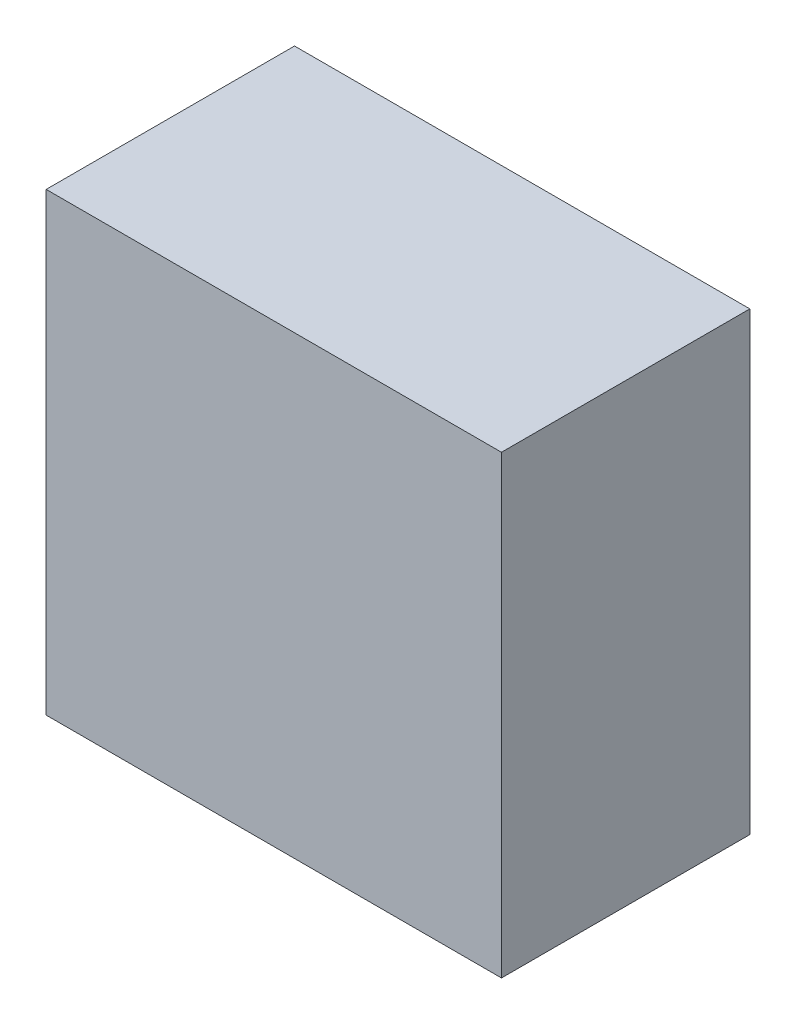
from build123d import *

# Parameters (mm, degrees)
ESQUISSE1_W        = 22
ESQUISSE1_H        = 22
BOSS_EXTRU_1_DEPTH = 12


with BuildPart() as part:
    # Esquisse1 → Boss.-Extru.1 (new body)
    with BuildSketch(Plane.XY):
        Rectangle(ESQUISSE1_W, ESQUISSE1_H)
    extrude(amount=BOSS_EXTRU_1_DEPTH)


solid = part.part
